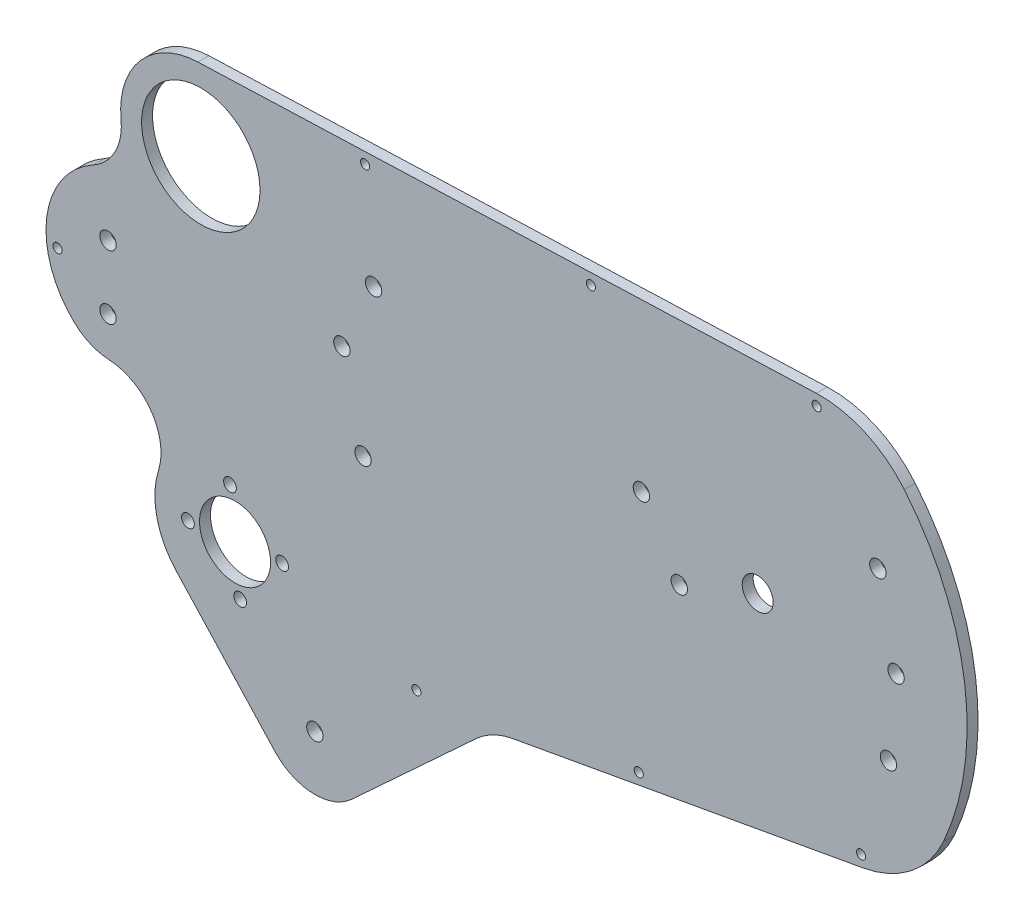
from build123d import *

# Parameters (mm, degrees)
SKETCH1_R           = 2.25
SKETCH1_R_2         = 16.25
SKETCH1_R_3         = 4.25
SKETCH1_R_4         = 1.75
SKETCH1_R_5         = 9.75
BOSS_EXTRUDE1_DEPTH = 3
SKETCH2_R           = 1.25
CUT_EXTRUDE1_DEPTH  = 190.515777006


with BuildPart() as part:
    # Sketch1 → Boss-Extrude1 (new body)
    with BuildSketch(Plane.XY):
        with BuildLine():
            ThreePointArc((-137.970351553, -33.480224156), (-126.431132561, -39.888203569), (-124.422839539, -52.93360637))
            ThreePointArc((-124.422839539, -52.93360637), (-124.888175134, -64.31939994), (-119.594822483, -74.410646153))
            Line((-119.594822483, -74.410646153), (-92.540517723, -103.740413224))
            ThreePointArc((-92.540517723, -103.740413224), (-82.119700521, -108.557935129), (-71.344567605, -104.595807028))
            Line((-71.344567605, -104.595807028), (-37.221129556, -73.119733925))
            ThreePointArc((-37.221129556, -73.119733925), (-32.538343047, -69.892896145), (-27.140055215, -68.104192696))
            Line((-27.140055215, -68.104192696), (68.925058584, -50.795851294))
            ThreePointArc((68.925058584, -50.795851294), (82.107908339, -44.886103489), (91, -33.5))
            ThreePointArc((91, -33.5), (96.805715124, 7.17766304), (80.26119478, 44.789595257))
            ThreePointArc((80.26119478, 44.789595257), (69.434281248, 53.01522195), (56.08825014, 55.616461034))
            Line((56.08825014, 55.616461034), (-113.612398701, 49.485657112))
            ThreePointArc((-113.612398701, 49.485657112), (-129.404310002, 41.953312576), (-134.705774542, 25.279526249))
            ThreePointArc((-134.705774542, 25.279526249), (-136.343375771, 16.802270376), (-142.382746132, 10.632050724))
            ThreePointArc((-142.382746132, 10.632050724), (-155.099864059, -8.058287742), (-147.542861296, -29.364285714))
            ThreePointArc((-147.542861296, -29.364285714), (-143.125485566, -32.280163581), (-137.970351553, -33.480224156))
        make_face()
        with Locations((-81.514845762, -93.570135067)):
            Circle(SKETCH1_R, mode=Mode.SUBTRACT)
        with Locations((-138.3, -22.75)):
            Circle(SKETCH1_R, mode=Mode.SUBTRACT)
        with Locations((-138.3, -5.25)):
            Circle(SKETCH1_R, mode=Mode.SUBTRACT)
        with Locations((-68.3, -21.5)):
            Circle(SKETCH1_R, mode=Mode.SUBTRACT)
        with Locations((-74.1, 1.7)):
            Circle(SKETCH1_R, mode=Mode.SUBTRACT)
        with Locations((-112.818118288, 27.5)):
            Circle(SKETCH1_R_2, mode=Mode.SUBTRACT)
        with Locations((-65.4, 20.2)):
            Circle(SKETCH1_R, mode=Mode.SUBTRACT)
        with Locations((18.5, -8.7)):
            Circle(SKETCH1_R, mode=Mode.SUBTRACT)
        with Locations((8.1, 8.2)):
            Circle(SKETCH1_R, mode=Mode.SUBTRACT)
        with Locations((75.9, -21.8)):
            Circle(SKETCH1_R, mode=Mode.SUBTRACT)
        with Locations((40.017782272, 0)):
            Circle(SKETCH1_R_3, mode=Mode.SUBTRACT)
        with Locations((78, -0.1)):
            Circle(SKETCH1_R, mode=Mode.SUBTRACT)
        with Locations((73, 22.4)):
            Circle(SKETCH1_R, mode=Mode.SUBTRACT)
        with Locations((-90.498978695, -58.098516388)):
            Circle(SKETCH1_R_4, mode=Mode.SUBTRACT)
        with Locations((-102.02811514, -72.419096433)):
            Circle(SKETCH1_R_4, mode=Mode.SUBTRACT)
        with Locations((-116.348695186, -60.889959988)):
            Circle(SKETCH1_R_4, mode=Mode.SUBTRACT)
        with Locations((-103.42383694, -59.494238188)):
            Circle(SKETCH1_R_5, mode=Mode.SUBTRACT)
        with Locations((-104.819558741, -46.569379943)):
            Circle(SKETCH1_R_4, mode=Mode.SUBTRACT)
    extrude(amount=BOSS_EXTRUDE1_DEPTH)

    # Sketch2 → Cut-Extrude1 (cut, through all)
    with BuildSketch(Plane.XY.offset(3)):
        with Locations((56.196560986, 52.618416878)):
            Circle(SKETCH2_R)
        with Locations((-5.763018236, 50.379992724)):
            Circle(SKETCH2_R)
        with Locations((-67.722597457, 48.14156857)):
            Circle(SKETCH2_R)
        with Locations((68.393104802, -47.843390427)):
            Circle(SKETCH2_R)
        with Locations((7.37558021, -58.837101935)):
            Circle(SKETCH2_R)
        with Locations((-152.133709173, -14)):
            Circle(SKETCH2_R)
        with Locations((-53.641944381, -69.830813444)):
            Circle(SKETCH2_R)
    extrude(amount=-CUT_EXTRUDE1_DEPTH, mode=Mode.SUBTRACT)


solid = part.part
